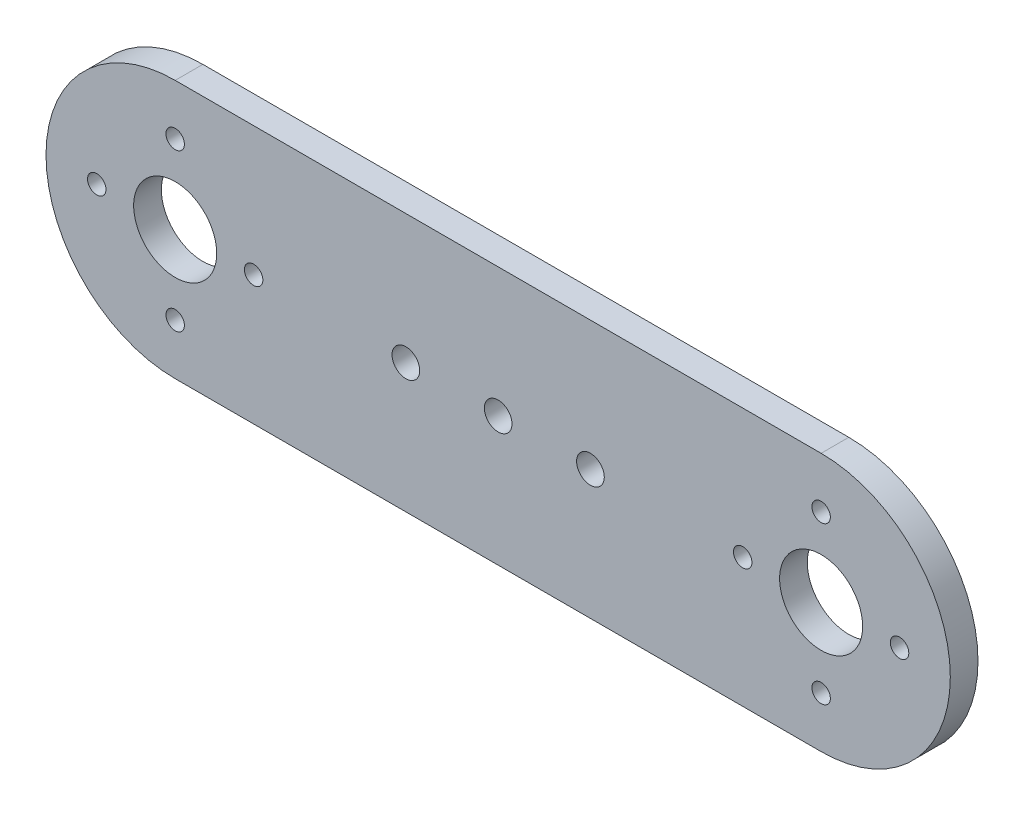
from build123d import *

# Parameters (mm, degrees)
SKETCH1_R           = 4.5
SKETCH1_R_2         = 1
SKETCH1_R_3         = 1.5
BOSS_EXTRUDE1_DEPTH = 3


with BuildPart() as part:
    # Sketch1 → Boss-Extrude1 (new body)
    with BuildSketch(Plane.XY):
        with BuildLine():
            Line((0, 14), (70, 14))
            ThreePointArc((70, 14), (84, 0), (70, -14))
            Line((70, -14), (0, -14))
            ThreePointArc((0, -14), (-14, 0), (0, 14))
        make_face()
        Circle(SKETCH1_R, mode=Mode.SUBTRACT)
        with Locations((0, 8.5)):
            Circle(SKETCH1_R_2, mode=Mode.SUBTRACT)
        with Locations((8.5, 0)):
            Circle(SKETCH1_R_2, mode=Mode.SUBTRACT)
        with Locations((0, -8.5)):
            Circle(SKETCH1_R_2, mode=Mode.SUBTRACT)
        with Locations((-8.5, 0)):
            Circle(SKETCH1_R_2, mode=Mode.SUBTRACT)
        with Locations((70, 0)):
            Circle(SKETCH1_R, mode=Mode.SUBTRACT)
        with Locations((70, 8.5)):
            Circle(SKETCH1_R_2, mode=Mode.SUBTRACT)
        with Locations((78.5, 0)):
            Circle(SKETCH1_R_2, mode=Mode.SUBTRACT)
        with Locations((70, -8.5)):
            Circle(SKETCH1_R_2, mode=Mode.SUBTRACT)
        with Locations((61.5, 0)):
            Circle(SKETCH1_R_2, mode=Mode.SUBTRACT)
        with Locations((25, 0)):
            Circle(SKETCH1_R_3, mode=Mode.SUBTRACT)
        with Locations((35, 0)):
            Circle(SKETCH1_R_3, mode=Mode.SUBTRACT)
        with Locations((45, 0)):
            Circle(SKETCH1_R_3, mode=Mode.SUBTRACT)
    extrude(amount=BOSS_EXTRUDE1_DEPTH)


solid = part.part
